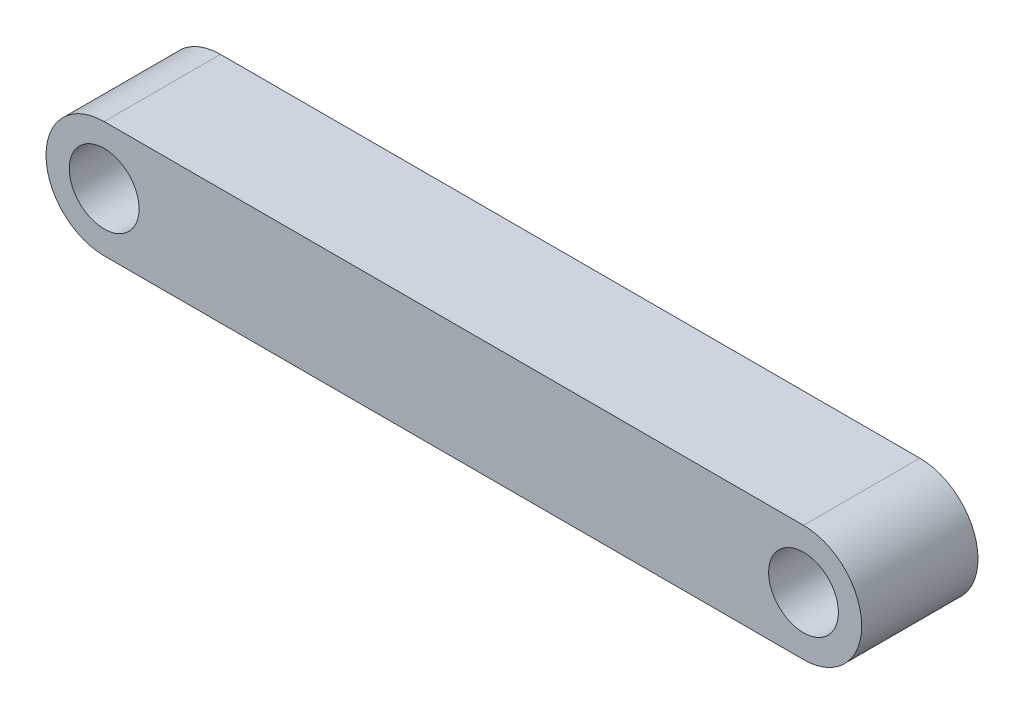
from build123d import *

# Parameters (mm, degrees)
SKETCH1_R           = 1.5
BOSS_EXTRUDE1_DEPTH = 2.5


with BuildPart() as part:
    # Sketch1 → Boss-Extrude1 (new, symmetric)
    with BuildSketch(Plane.XY):
        with BuildLine():
            Line((-15.03125, 2.5), (15.03125, 2.5))
            ThreePointArc((15.03125, 2.5), (17.53125, 0), (15.03125, -2.5))
            Line((15.03125, -2.5), (-15.03125, -2.5))
            ThreePointArc((-15.03125, -2.5), (-17.53125, 0), (-15.03125, 2.5))
        make_face()
        with Locations((-15.03125, 0)):
            Circle(SKETCH1_R, mode=Mode.SUBTRACT)
        with Locations((15.03125, 0)):
            Circle(SKETCH1_R, mode=Mode.SUBTRACT)
    extrude(amount=BOSS_EXTRUDE1_DEPTH, both=True)


solid = part.part
